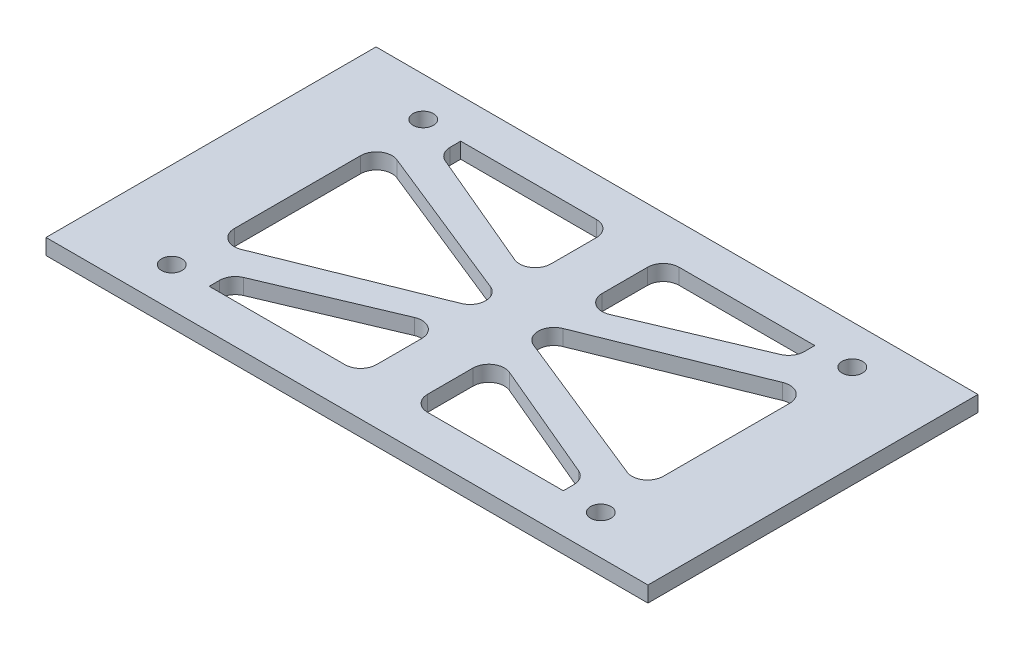
from build123d import *

# Parameters (mm, degrees)
SKETCH1_W           = 97.282
SKETCH1_H           = 53.34
BOSS_EXTRUDE1_DEPTH = 2.54
SKETCH2_R           = 1.651
CUT_EXTRUDE1_DEPTH  = 56.530958762


with BuildPart() as part:
    # Sketch1 → Boss-Extrude1 (new body)
    with BuildSketch(Plane(origin=(0, 0, 0), x_dir=(1, 0, 0), z_dir=(0, 1, 0))):
        Rectangle(SKETCH1_W, SKETCH1_H)
    extrude(amount=BOSS_EXTRUDE1_DEPTH)

    # Sketch2 → Cut-Extrude1 (cut, through all)
    with BuildSketch(Plane(origin=(0, 2.54, 0), x_dir=(1, 0, 0), z_dir=(0, 1, 0))):
        with Locations(Location((-34.671, 20.32, 0), (0, 0, 270))):
            Circle(SKETCH2_R)
        with BuildLine():
            ThreePointArc((-4.137168556, 10.430937018), (-5.273705168, 8.313889423), (-7.666216208, 8.091410411))
            Line((-7.666216208, 8.091410411), (-27.062123692, 16.291136246))
            ThreePointArc((-27.062123692, 16.291136246), (-28.190123635, 17.227199464), (-28.61307604, 18.630662853))
            Line((-28.61307604, 18.630662853), (-28.61307604, 20.32))
            Line((-28.61307604, 20.32), (-6.677168556, 20.32))
            ThreePointArc((-6.677168556, 20.32), (-4.881117332, 19.576051224), (-4.137168556, 17.78))
            Line((-4.137168556, 17.78), (-4.137168556, 10.430937018))
        make_face()
        with BuildLine():
            Line((-34.671, 10.20811999), (-34.671, -10.20811999))
            ThreePointArc((-34.671, -10.20811999), (-33.552342054, -12.313205919), (-31.181719082, -12.564062634))
            Line((-31.181719082, -12.564062634), (-5.847021287, -2.355942643))
            ThreePointArc((-5.847021287, -2.355942643), (-4.256302206, 0), (-5.847021287, 2.355942643))
            Line((-5.847021287, 2.355942643), (-31.181719082, 12.564062634))
            ThreePointArc((-31.181719082, 12.564062634), (-33.552342054, 12.313205919), (-34.671, 10.20811999))
        make_face()
        with BuildLine():
            ThreePointArc((-28.61307604, -18.630662853), (-28.190123635, -17.227199464), (-27.062123692, -16.291136246))
            Line((-27.062123692, -16.291136246), (-7.666216208, -8.091410411))
            ThreePointArc((-7.666216208, -8.091410411), (-5.273705168, -8.313889423), (-4.137168556, -10.430937018))
            Line((-4.137168556, -10.430937018), (-4.137168556, -17.78))
            ThreePointArc((-4.137168556, -17.78), (-4.881117332, -19.576051224), (-6.677168556, -20.32))
            Line((-6.677168556, -20.32), (-28.61307604, -20.32))
            Line((-28.61307604, -20.32), (-28.61307604, -18.630662853))
        make_face()
        with BuildLine():
            ThreePointArc((4.137168556, -10.430937018), (5.273705168, -8.313889423), (7.666216208, -8.091410411))
            Line((7.666216208, -8.091410411), (27.062123692, -16.291136246))
            ThreePointArc((27.062123692, -16.291136246), (28.190123635, -17.227199464), (28.61307604, -18.630662853))
            Line((28.61307604, -18.630662853), (28.61307604, -20.32))
            Line((28.61307604, -20.32), (6.677168556, -20.32))
            ThreePointArc((6.677168556, -20.32), (4.881117332, -19.576051224), (4.137168556, -17.78))
            Line((4.137168556, -17.78), (4.137168556, -10.430937018))
        make_face()
        with BuildLine():
            Line((34.671, 10.20811999), (34.671, -10.20811999))
            ThreePointArc((34.671, -10.20811999), (33.552342054, -12.313205919), (31.181719082, -12.564062634))
            Line((31.181719082, -12.564062634), (5.847021287, -2.355942643))
            ThreePointArc((5.847021287, -2.355942643), (4.256302206, 0), (5.847021287, 2.355942643))
            Line((5.847021287, 2.355942643), (31.181719082, 12.564062634))
            ThreePointArc((31.181719082, 12.564062634), (33.552342054, 12.313205919), (34.671, 10.20811999))
        make_face()
        with BuildLine():
            ThreePointArc((4.137168556, 17.78), (4.881117332, 19.576051224), (6.677168556, 20.32))
            Line((6.677168556, 20.32), (28.61307604, 20.32))
            Line((28.61307604, 20.32), (28.61307604, 18.630662853))
            ThreePointArc((28.61307604, 18.630662853), (28.190123635, 17.227199464), (27.062123692, 16.291136246))
            Line((27.062123692, 16.291136246), (7.666216208, 8.091410411))
            ThreePointArc((7.666216208, 8.091410411), (5.273705168, 8.313889423), (4.137168556, 10.430937018))
            Line((4.137168556, 10.430937018), (4.137168556, 17.78))
        make_face()
        with Locations(Location((34.671, 20.32, 0), (0, 0, 270))):
            Circle(SKETCH2_R)
        with Locations(Location((34.671, -20.32, 0), (0, 0, 270))):
            Circle(SKETCH2_R)
        with Locations(Location((-34.671, -20.32, 0), (0, 0, 90))):
            Circle(SKETCH2_R)
    extrude(amount=-CUT_EXTRUDE1_DEPTH, mode=Mode.SUBTRACT)


solid = part.part
